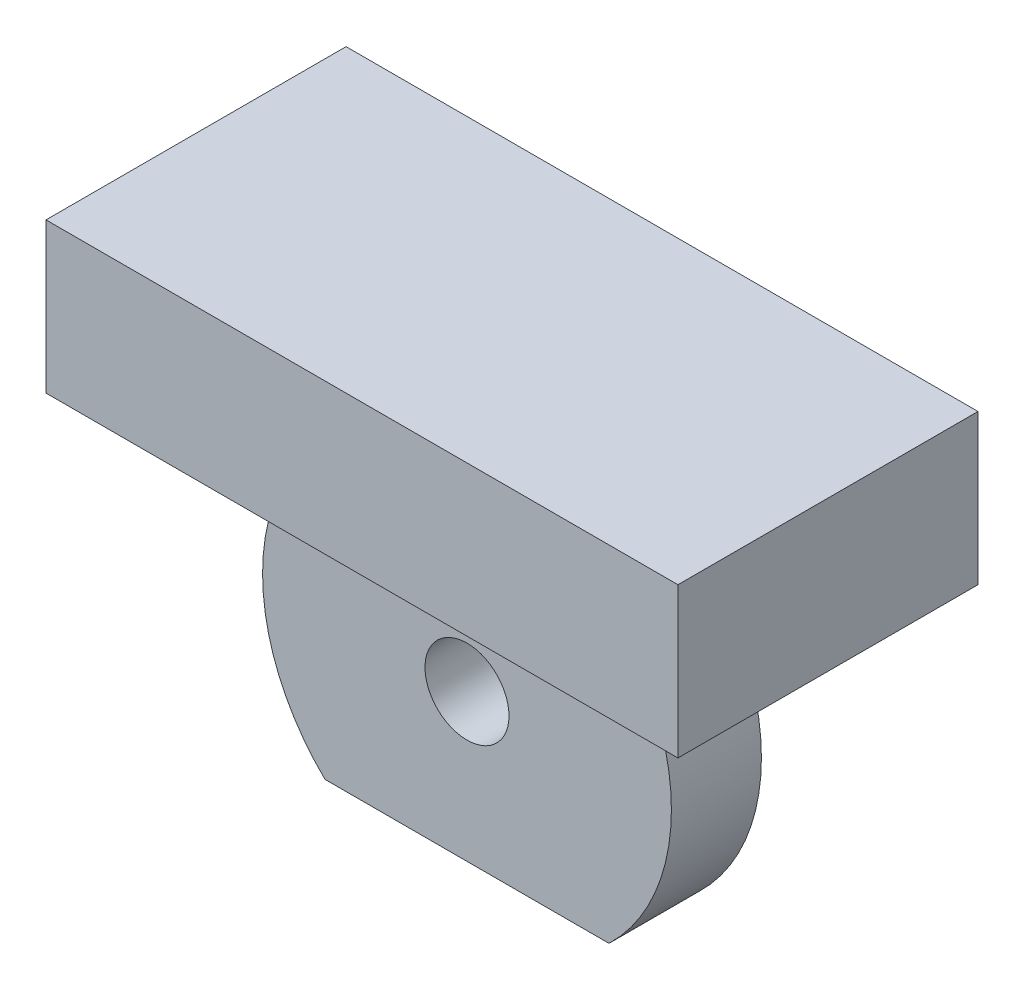
from build123d import *

# Parameters (mm, degrees)
SKETCH1_W           = 42.12
SKETCH1_H           = 10
BOSS_EXTRUDE1_DEPTH = 10
SKETCH2_R           = 2.8
BOSS_EXTRUDE2_DEPTH = 3


with BuildPart() as part:
    # Sketch1 → Boss-Extrude1 (new, symmetric)
    with BuildSketch(Plane.XY):
        with Locations((21.06, -5)):
            Rectangle(SKETCH1_W, SKETCH1_H)
    extrude(amount=BOSS_EXTRUDE1_DEPTH, both=True)

    # Sketch2 → Boss-Extrude2 (add, symmetric)
    with BuildSketch(Plane.XY):
        with BuildLine():
            Line((11.595, -30), (30.525, -30))
            ThreePointArc((30.525, -30), (34.684463962, -20.214378878), (30.545664183, -10.42))
            Line((30.545664183, -10.42), (39.681383671, -10.42))
            Line((39.681383671, -10.42), (39.681383671, -10))
            Line((39.681383671, -10), (2.438616329, -10))
            Line((2.438616329, -10), (2.438616329, -10.42))
            Line((2.438616329, -10.42), (11.574335817, -10.42))
            ThreePointArc((11.574335817, -10.42), (7.435536038, -20.214378878), (11.595, -30))
        make_face()
        with Locations((21.06, -20.2)):
            Circle(SKETCH2_R, mode=Mode.SUBTRACT)
    extrude(amount=BOSS_EXTRUDE2_DEPTH, both=True)


solid = part.part
